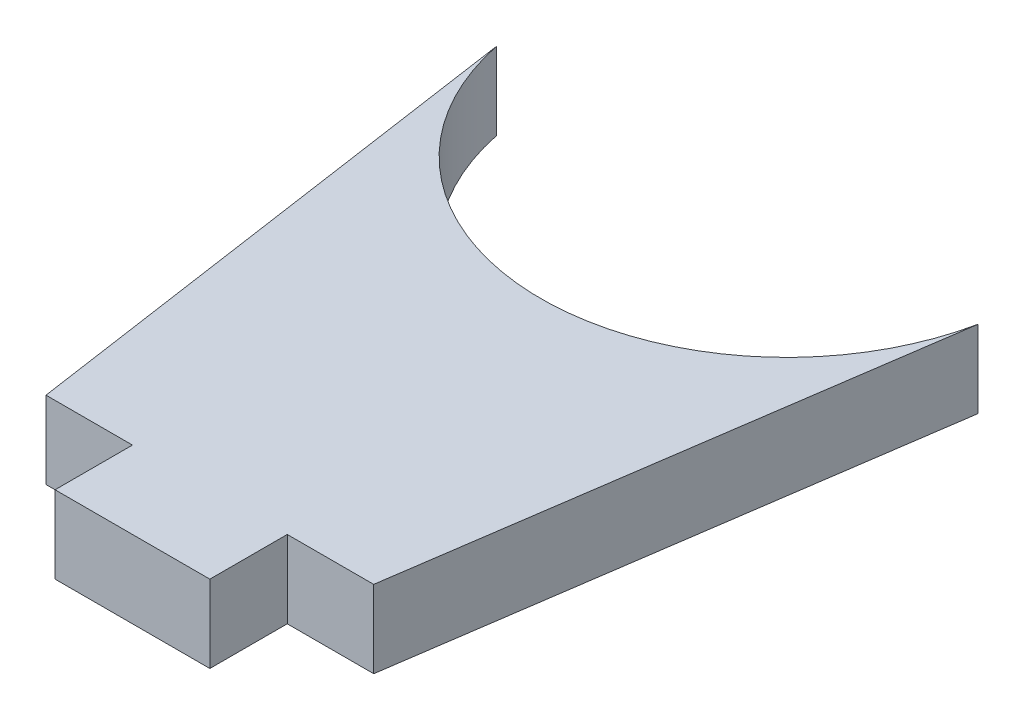
from build123d import *

# Parameters (mm, degrees)
BOSS_EXTRUDE1_DEPTH = 2.5


with BuildPart() as part:
    # Sketch1 → Boss-Extrude1 (new, symmetric)
    with BuildSketch(Plane(origin=(0, 0, 0), x_dir=(-1, 0, 0), z_dir=(0, 1, 0))):
        with BuildLine():
            Line((-5, 37.258597416), (-10.584590832, 37.258597416))
            Line((-10.584590832, 37.258597416), (-15.551383484, 3.189058909))
            ThreePointArc((-15.551383484, 3.189058909), (0, 15.875), (15.551383484, 3.189058909))
            Line((15.551383484, 3.189058909), (10.584590832, 37.258597416))
            Line((10.584590832, 37.258597416), (5, 37.258597416))
            Line((5, 37.258597416), (5, 42.258597416))
            Line((5, 42.258597416), (-5, 42.258597416))
            Line((-5, 42.258597416), (-5, 37.258597416))
        make_face()
    extrude(amount=BOSS_EXTRUDE1_DEPTH, both=True)


solid = part.part
